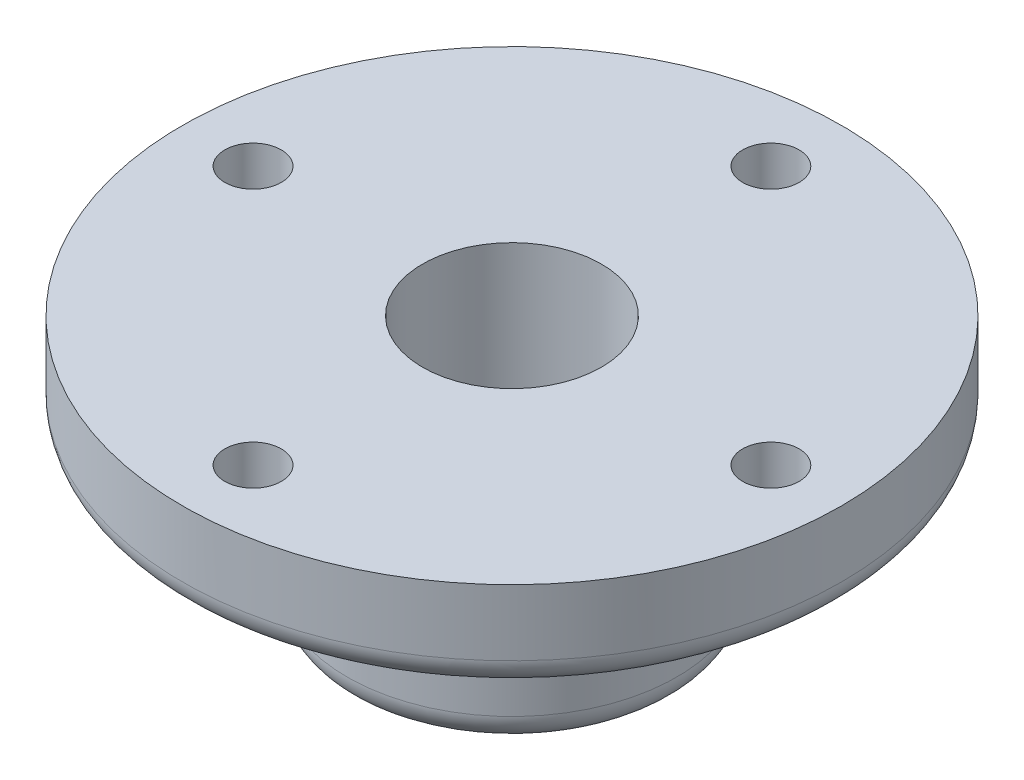
from build123d import *

# Parameters (mm, degrees)
FILLET1_R          = 6
SKETCH2_R          = 6
CUT_EXTRUDE1_DEPTH = 114.247516591


with BuildPart() as part:
    # Sketch1 → Revolve2 (revolve)
    with BuildSketch(Plane.XY, mode=Mode.PRIVATE) as revolve2_sk:
        Polygon((-19, 0), (-70, 0), (-70, -20), (-35, -20), (-35, -55), (-19, -55), align=None)
    revolve(revolve2_sk.sketch.rotate(Axis((0, -1000, 0), (0, 1, 0)), 180), axis=Axis((0, -1000, 0), (0, 1, 0)))

    # Fillet1
    fillet1_edges = [part.edges().sort_by_distance(p)[0] for p in [
        (-35, -55, 0),
        (-35, -20, 0),
        (-70, -20, 0),
    ]]
    fillet(fillet1_edges, radius=FILLET1_R)

    # Sketch2 → Cut-Extrude1 (cut, through all)
    with BuildSketch(Plane(origin=(0, 0, 0), x_dir=(1, 0, 0), z_dir=(0, 1, 0))):
        with Locations(Location((0, 55, 0), (0, 0, 270))):
            Circle(SKETCH2_R)
        with Locations(Location((55, 0, 0), (0, 0, 270))):
            Circle(SKETCH2_R)
        with Locations(Location((0, -55, 0), (0, 0, 270))):
            Circle(SKETCH2_R)
        with Locations(Location((-55, 0, 0), (0, 0, 270))):
            Circle(SKETCH2_R)
    extrude(amount=-CUT_EXTRUDE1_DEPTH, mode=Mode.SUBTRACT)


solid = part.part
